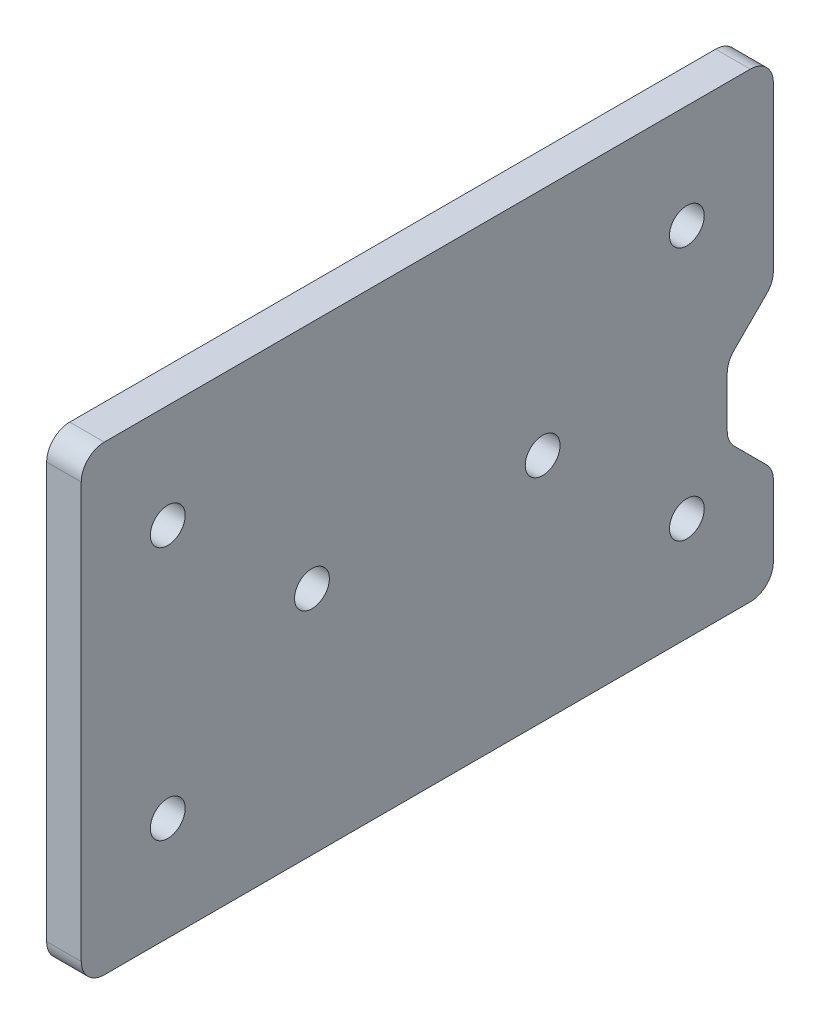
from build123d import *

# Parameters (mm, degrees)
SKETCH_1_W          = 60
SKETCH_1_H          = 40
EXTRUDE_1_DEPTH     = 3
SKETCH_2_R          = 1.51
CUT_EXTRUDE_1_DEPTH = 10
SKETCH_3_R          = 1.51
CUT_EXTRUDE_2_DEPTH = 10
CUT_EXTRUDE_3_DEPTH = 10
FILLET_1_R          = 2


with BuildPart() as part:
    # 草图1 → 凸台-拉伸1 (new body)
    with BuildSketch(Plane(origin=(0, 0, 0), x_dir=(0, 0, -1), z_dir=(1, 0, 0))):
        Rectangle(SKETCH_1_W, SKETCH_1_H)
    extrude(amount=EXTRUDE_1_DEPTH)

    # 草图2 → 切除-拉伸1 (cut)
    with BuildSketch(Plane.ZY):
        with Locations((-22.5, -11)):
            Circle(SKETCH_2_R)
        with Locations((22.5, -11)):
            Circle(SKETCH_2_R)
        with Locations((22.5, 11)):
            Circle(SKETCH_2_R)
        with Locations((-22.5, 11)):
            Circle(SKETCH_2_R)
    extrude(amount=-CUT_EXTRUDE_1_DEPTH, mode=Mode.SUBTRACT)

    # 草图3 → 切除-拉伸2 (cut)
    with BuildSketch(Plane.ZY):
        with Locations((10, 0)):
            Circle(SKETCH_3_R)
        with Locations((-10, 0)):
            Circle(SKETCH_3_R)
    extrude(amount=-CUT_EXTRUDE_2_DEPTH, mode=Mode.SUBTRACT)

    # 草图4 → 切除-拉伸3 (cut)
    with BuildSketch(Plane(origin=(3, 0, 0), x_dir=(0, 0, -1), z_dir=(1, 0, 0))):
        Polygon((26, -7), (30, -11), (30, 3), (26, -1), align=None)
    extrude(amount=-CUT_EXTRUDE_3_DEPTH, mode=Mode.SUBTRACT)

    # 圆角1
    fillet_1_edges = [part.edges().sort_by_distance(p)[0] for p in [
        (1.5, -1, -26),
        (1.5, 3, -30),
        (1.5, -11, -30),
        (1.5, -7, -26),
        (1.5, -20, -30),
        (1.5, -20, 30),
        (1.5, 20, 30),
        (1.5, 20, -30),
    ]]
    fillet(fillet_1_edges, radius=FILLET_1_R)


solid = part.part
